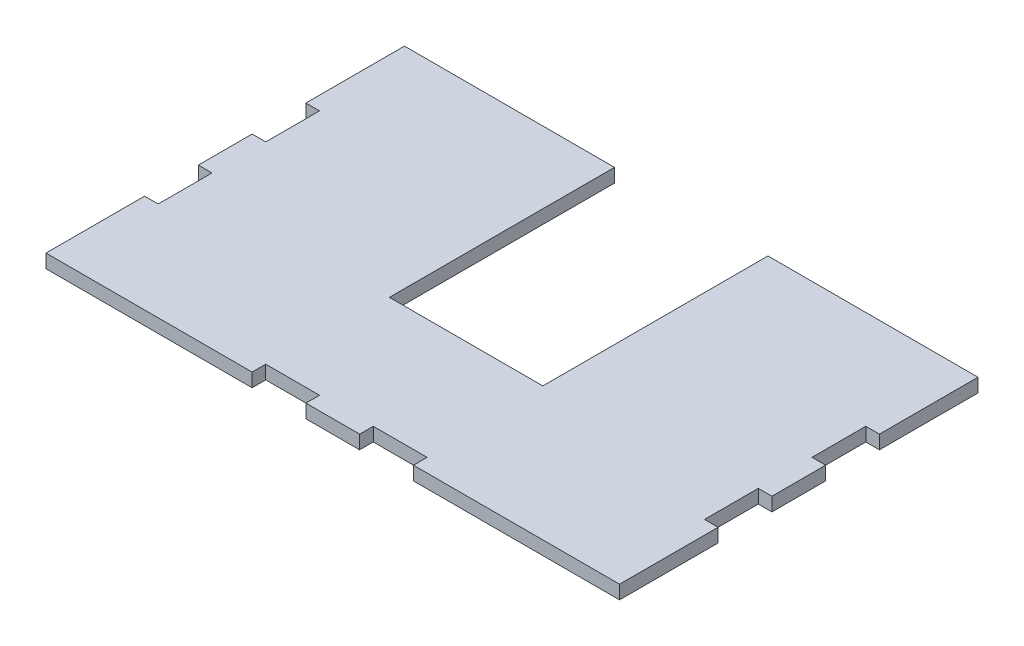
from build123d import *

# Parameters (mm, degrees)
SKETCH1_W        = 203.2
SKETCH1_H        = 177.8
BASE_DEPTH       = 4.826
SKETCH5_W        = 203.2
SKETCH5_H        = 50.8
TRIM_DEPTH       = 271.048829429
SKETCH3_W        = 54.356
SKETCH3_H        = 79.756
CENTER_CUT_DEPTH = 240.67171355
SKETCH2_W        = 4.826
SKETCH2_H        = 19.05
SIDE_SLOTS_DEPTH = 240.67171355
SKETCH4_W        = 19.05
SKETCH4_H        = 4.826
REAR_SLOTS_DEPTH = 240.67171355


with BuildPart() as part:
    # Sketch1 → Base (new body)
    with BuildSketch(Plane(origin=(0, 0, 0), x_dir=(1, 0, 0), z_dir=(0, 1, 0))):
        with Locations((101.6, 88.9)):
            Rectangle(SKETCH1_W, SKETCH1_H)
    extrude(amount=BASE_DEPTH)

    # Sketch5 → Trim (cut, through all)
    with BuildSketch(Plane(origin=(0, 4.826, 0), x_dir=(1, 0, 0), z_dir=(0, 1, 0))):
        with Locations((101.6, 152.4)):
            Rectangle(SKETCH5_W, SKETCH5_H)
    extrude(amount=-TRIM_DEPTH, mode=Mode.SUBTRACT)

    # Sketch3 → Center Cut (cut, through all)
    with BuildSketch(Plane(origin=(0, 4.826, 0), x_dir=(1, 0, 0), z_dir=(0, 1, 0))):
        with Locations((101.6, 87.122)):
            Rectangle(SKETCH3_W, SKETCH3_H)
    extrude(amount=-CENTER_CUT_DEPTH, mode=Mode.SUBTRACT)

    # Sketch2 → Side Slots (cut, through all)
    with BuildSketch(Plane(origin=(0, 4.826, 0), x_dir=(1, 0, 0), z_dir=(0, 1, 0))):
        with Locations((2.413, 82.55)):
            Rectangle(SKETCH2_W, SKETCH2_H)
        with Locations((2.413, 44.45)):
            Rectangle(SKETCH2_W, SKETCH2_H)
        with Locations((200.787, 44.45)):
            Rectangle(SKETCH2_W, SKETCH2_H)
        with Locations((200.787, 82.55)):
            Rectangle(SKETCH2_W, SKETCH2_H)
    extrude(amount=-SIDE_SLOTS_DEPTH, mode=Mode.SUBTRACT)

    # Sketch4 → Rear Slots (cut, through all)
    with BuildSketch(Plane(origin=(0, 4.826, 0), x_dir=(1, 0, 0), z_dir=(0, 1, 0))):
        with Locations((82.55, 2.413)):
            Rectangle(SKETCH4_W, SKETCH4_H)
        with Locations((120.65, 2.413)):
            Rectangle(SKETCH4_W, SKETCH4_H)
    extrude(amount=-REAR_SLOTS_DEPTH, mode=Mode.SUBTRACT)


solid = part.part
